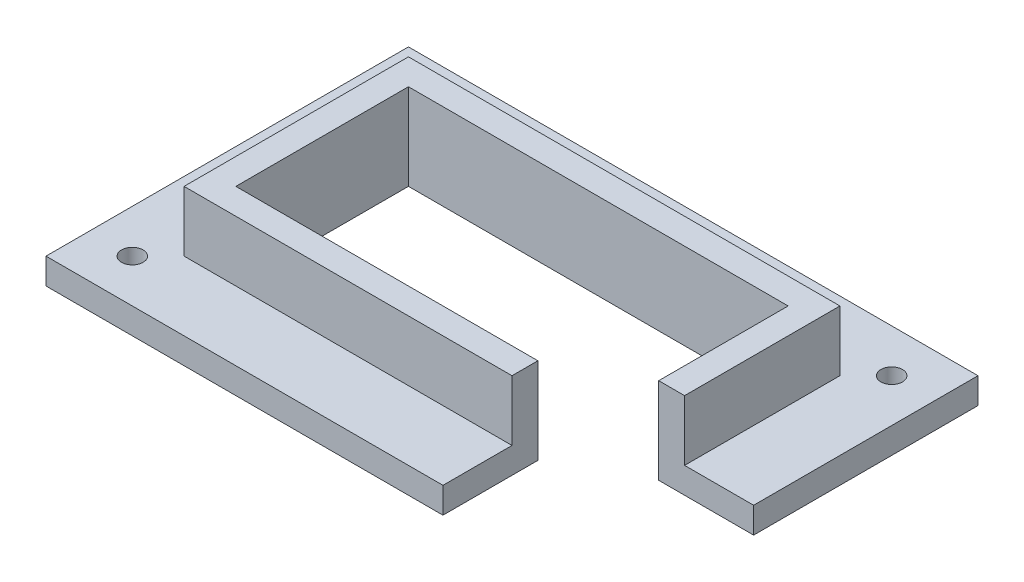
from build123d import *

# Parameters (mm, degrees)
BASE_DEPTH       = 3
WALL_DEPTH       = 7
SKETCH3_R        = 1.25
BOLT_SLOTS_DEPTH = 3


with BuildPart() as part:
    # Sketch1 → base (new body)
    with BuildSketch(Plane(origin=(0, 0, 0), x_dir=(1, 0, 0), z_dir=(0, 1, 0))):
        Polygon((13, -10), (13, -21), (-33, -21), (-33, 21), (33, 21), (33, -5), (22, -5), (22, 10), (-22, 10), (-22, -10), align=None)
    extrude(amount=BASE_DEPTH)

    # Sketch2 → wall (add)
    with BuildSketch(Plane(origin=(0, 3, 0), x_dir=(1, 0, 0), z_dir=(0, 1, 0))):
        Polygon((13, -10), (13, -13), (-25, -13), (-25, 13), (25, 13), (25, -5), (22, -5), (22, 10), (-22, 10), (-22, -10), align=None)
    extrude(amount=WALL_DEPTH)

    # Sketch3 → bolt slots (cut)
    with BuildSketch(Plane(origin=(0, 3, 0), x_dir=(1, 0, 0), z_dir=(0, 1, 0))):
        with Locations(Location((-28, -16, 0), (0, 0, 270))):
            Circle(SKETCH3_R)
        with Locations(Location((-28, 16, 0), (0, 0, 270))):
            Circle(SKETCH3_R)
        with Locations(Location((28, 16, 0), (0, 0, 270))):
            Circle(SKETCH3_R)
    extrude(amount=-BOLT_SLOTS_DEPTH, mode=Mode.SUBTRACT)


solid = part.part
